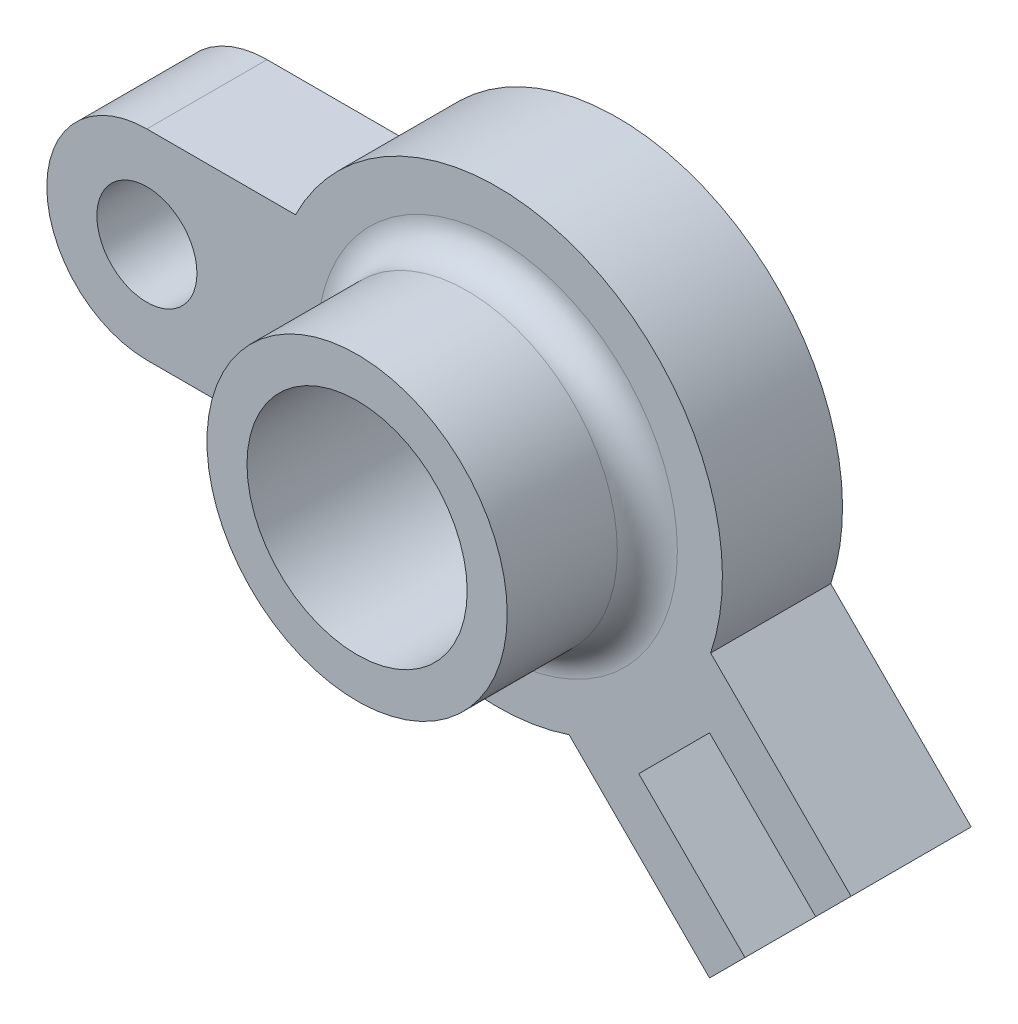
from build123d import *

# Parameters (mm, degrees)
SALIENTE_EXTRUIR1_DEPTH = 12
CROQUIS4_R              = 15
SALIENTE_EXTRUIR2_DEPTH = 14
CROQUIS5_R              = 11
CORTAR_EXTRUIR3_DEPTH   = 18
REDONDEO1_R             = 3
CORTAR_EXTRUIR4_DEPTH   = 8
CORTAR_EXTRUIR6_REACH   = 60.915
CROQUIS2_R              = 5


with BuildPart() as part:
    # Croquis1 → Saliente-Extruir1 (new body)
    with BuildSketch(Plane.XY):
        with BuildLine():
            Line((7.181125002, -21.323260626), (21.213203436, -35.355339059))
            Line((21.213203436, -35.355339059), (35.355339059, -21.213203436))
            Line((35.355339059, -21.213203436), (21.323260626, -7.181125002))
            ThreePointArc((21.323260626, -7.181125002), (8.610377228, 20.787289482), (-20.155644371, 10))
            Line((-20.155644371, 10), (-35, 10))
            ThreePointArc((-35, 10), (-45, 0), (-35, -10))
            Line((-35, -10), (-20.155644371, -10))
            ThreePointArc((-20.155644371, -10), (-8.610377228, -20.787289482), (7.181125002, -21.323260626))
        make_face()
    extrude(amount=SALIENTE_EXTRUIR1_DEPTH)

    # Croquis4 → Saliente-Extruir2 (add)
    with BuildSketch(Plane.XY.offset(12)):
        Circle(CROQUIS4_R)
    extrude(amount=SALIENTE_EXTRUIR2_DEPTH)

    # Croquis5 → Cortar-Extruir3 (cut)
    with BuildSketch(Plane.XY.offset(26)):
        Circle(CROQUIS5_R)
    extrude(amount=-CORTAR_EXTRUIR3_DEPTH, mode=Mode.SUBTRACT)

    # Redondeo1
    redondeo1_edges = [part.edges().sort_by_distance(p)[0] for p in [
        (-15, 0, 12),
    ]]
    fillet(redondeo1_edges, radius=REDONDEO1_R)

    # Croquis3 → Cortar-Extruir4 (cut)
    with BuildSketch(Plane.XY.offset(12)):
        Polygon((31.819805153, -24.748737342), (21.213203436, -14.142135624), (14.142135624, -21.213203436), (24.748737342, -31.819805153), align=None)
    extrude(amount=-CORTAR_EXTRUIR4_DEPTH, mode=Mode.SUBTRACT)

    # Croquis2 → Cortar-Extruir6 (cut, up to next)
    with BuildSketch(Plane.XY.offset(12), mode=Mode.PRIVATE) as cortar_extruir6_sk1:
        with Locations((-35, 0)):
            Circle(CROQUIS2_R)
    cortar_extruir6_tool1 = extrude(cortar_extruir6_sk1.sketch, amount=-CORTAR_EXTRUIR6_REACH, mode=Mode.PRIVATE) & part.part
    add(cortar_extruir6_tool1.solids().sort_by_distance((-35, 0, 12))[0], mode=Mode.SUBTRACT)


solid = part.part
